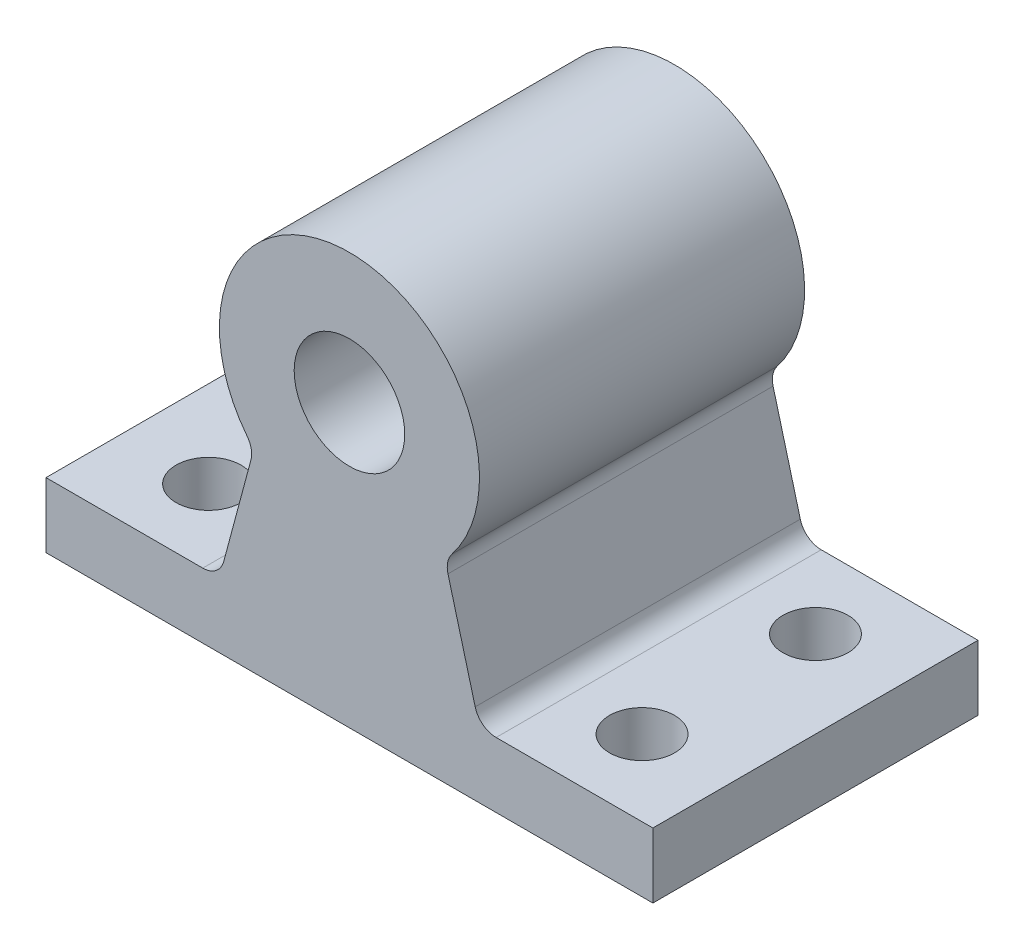
from build123d import *

# Parameters (mm, degrees)
SKETCH_1_R          = 6
SKETCH_1_R_2        = 2.55
EXTRUDE_1_DEPTH     = 7.5
SKETCH_2_R          = 1.5
CUT_EXTRUDE_1_DEPTH = 25.763884994
CUT_EXTRUDE_2_DEPTH = 9.5
FILLET_1_R          = 1


with BuildPart() as part:
    # 草图1 → 凸台-拉伸1 (new, symmetric)
    # profile 1 of 2: a face of its own
    with BuildSketch(Plane.XY):
        with Locations((0, 13)):
            Circle(SKETCH_1_R)
        with Locations((0, 13)):
            Circle(SKETCH_1_R_2, mode=Mode.SUBTRACT)
    # profile 2 of 2: a face of its own
    with BuildSketch(Plane.XY):
        with BuildLine():
            ThreePointArc((4.410490728, 8.932129361), (0, 7), (-4.410490728, 8.932129361))
            Line((-4.410490728, 8.932129361), (-6, 3))
            Line((-6, 3), (-14, 3))
            Line((-14, 3), (-14, 0))
            Line((-14, 0), (14, 0))
            Line((14, 0), (14, 3))
            Line((14, 3), (6, 3))
            Line((6, 3), (4.410490728, 8.932129361))
        make_face()
    extrude(amount=EXTRUDE_1_DEPTH, both=True)

    # 草图2 → 切除-拉伸1 (cut, through all)
    with BuildSketch(Plane.XZ):
        with Locations((-10, 4)):
            Circle(SKETCH_2_R)
        with Locations((-10, -4)):
            Circle(SKETCH_2_R)
        with Locations((10, -4)):
            Circle(SKETCH_2_R)
        with Locations(Location((10, 4, 0), (0, 0, 180))):
            Circle(SKETCH_2_R)
    extrude(amount=-CUT_EXTRUDE_1_DEPTH, mode=Mode.SUBTRACT)

    # 草图3 → 切除-拉伸2 (cut)
    with BuildSketch(Plane(origin=(0, 0, -7.5), x_dir=(-1, 0, 0), z_dir=(0, 0, -1))):
        Polygon((0, 8.150257739), (4.2, 10.575128869), (4.2, 15.424871131), (0, 17.849742261), (-4.2, 15.424871131), (-4.2, 10.575128869), align=None)
    extrude(amount=-CUT_EXTRUDE_2_DEPTH, mode=Mode.SUBTRACT)

    # 圆角1
    fillet_1_edges = [part.edges().sort_by_distance(p)[0] for p in [
        (4.410490728, 8.932129361, 0),
        (6, 3, 0),
        (-6, 3, 0),
        (-4.410490728, 8.932129361, 0),
        (0, 8.150257739, -2.75),
        (4.2, 10.575128869, -2.75),
        (4.2, 15.424871131, -2.75),
        (0, 17.849742261, -2.75),
        (-4.2, 15.424871131, -2.75),
        (-4.2, 10.575128869, -2.75),
    ]]
    fillet(fillet_1_edges, radius=FILLET_1_R)


solid = part.part
